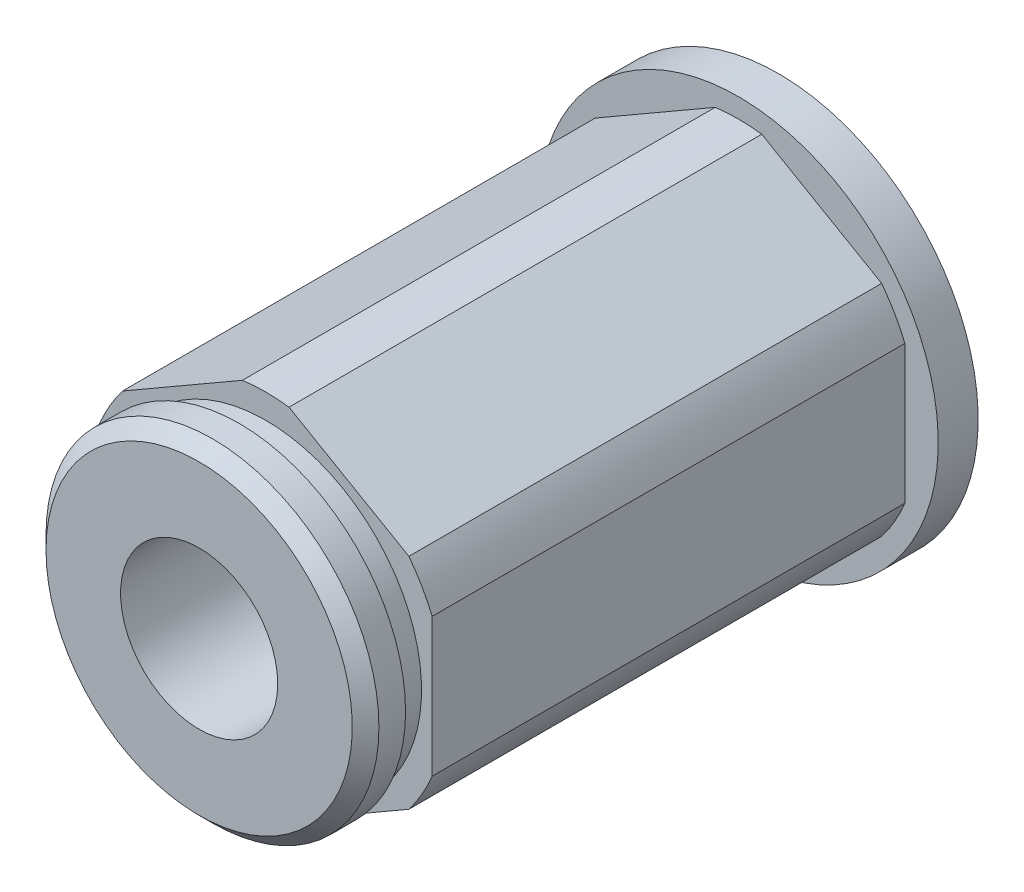
from build123d import *

# Parameters (mm, degrees)
BASIC_ROD_DEPTH         = 9.779
BASIC_ROD_DEPTH_BACK    = 9.779
SKETCH1_R               = 6.35
THEX_DEPTH              = 9.779
INTERNAL_CUT_DEPTH      = 16.471718641
INTERNAL_CUT_DEPTH_BACK = 16.471718641
SKETCH2_R               = 2.9972
BOSS_EXTRUDE1_START     = -1.524
SKETCH9_R               = 7.62
SKETCH9_R_2             = 2.9972
BOSS_EXTRUDE1_DEPTH     = 1.524


with BuildPart() as part:
    # Sketch1 → Basic Rod (new, two sides: drawn at the far end of the back side and taken through both)
    with BuildSketch(Plane.XY.offset(-BASIC_ROD_DEPTH_BACK)):
        Circle(SKETCH1_R)
    extrude(amount=BASIC_ROD_DEPTH + BASIC_ROD_DEPTH_BACK)

    # Sketch8 → THex (add, symmetric)
    with BuildSketch(Plane.XY):
        with BuildLine():
            Line((-0.888411378, 6.819423871), (-5.461588622, 4.179098758))
            ThreePointArc((-5.461588622, 4.179098758), (-5.955700003, 3.438525), (-6.35, 2.640325113))
            Line((-6.35, 2.640325113), (-6.35, -2.640325113))
            ThreePointArc((-6.35, -2.640325113), (-5.955700003, -3.438525), (-5.461588622, -4.179098758))
            Line((-5.461588622, -4.179098758), (-0.888411378, -6.819423871))
            ThreePointArc((-0.888411378, -6.819423871), (0, -6.87705), (0.888411378, -6.819423871))
            Line((0.888411378, -6.819423871), (5.461588622, -4.179098758))
            ThreePointArc((5.461588622, -4.179098758), (5.955700003, -3.438525), (6.35, -2.640325113))
            Line((6.35, -2.640325113), (6.35, 2.640325113))
            ThreePointArc((6.35, 2.640325113), (5.955700003, 3.438525), (5.461588622, 4.179098758))
            Line((5.461588622, 4.179098758), (0.888411378, 6.819423871))
            ThreePointArc((0.888411378, 6.819423871), (0, 6.87705), (-0.888411378, 6.819423871))
        make_face()
    extrude(amount=THEX_DEPTH, both=True)

    # Sketch7 → 1stSnapRing (revolve)
    with BuildSketch(Plane(origin=(0, 0, 0), x_dir=(0, 0, -1), z_dir=(1, 0, 0)), mode=Mode.PRIVATE) as f_1stsnapring_sk:
        Polygon((-9.779, 5.9436), (-10.795, 5.9436), (-10.795, 6.35), (-11.811, 6.35), (-12.319, 5.842), (-12.319, 0), (-9.779, 0), align=None)
    revolve(f_1stsnapring_sk.sketch.rotate(Axis((0, 0, -38.2778), (0, 0, 1)), 90), axis=Axis((0, 0, -38.2778), (0, 0, 1)))

    # Sketch2 → Internal Cut (cut, two sides: drawn at the far end of the back side and taken through both)
    with BuildSketch(Plane.XY.offset(-INTERNAL_CUT_DEPTH_BACK)):
        Circle(SKETCH2_R)
    extrude(amount=INTERNAL_CUT_DEPTH + INTERNAL_CUT_DEPTH_BACK, mode=Mode.SUBTRACT)

    # Sketch9 → Boss-Extrude1 (add)
    with BuildSketch(Plane(origin=(0, 0, -9.779), x_dir=(-1, 0, 0), z_dir=(0, 0, -1)).offset(BOSS_EXTRUDE1_START)):
        Circle(SKETCH9_R)
        with Locations(Location((0, 0, 0), (0, 0, 180))):
            Circle(SKETCH9_R_2, mode=Mode.SUBTRACT)
    extrude(amount=BOSS_EXTRUDE1_DEPTH)


solid = part.part
